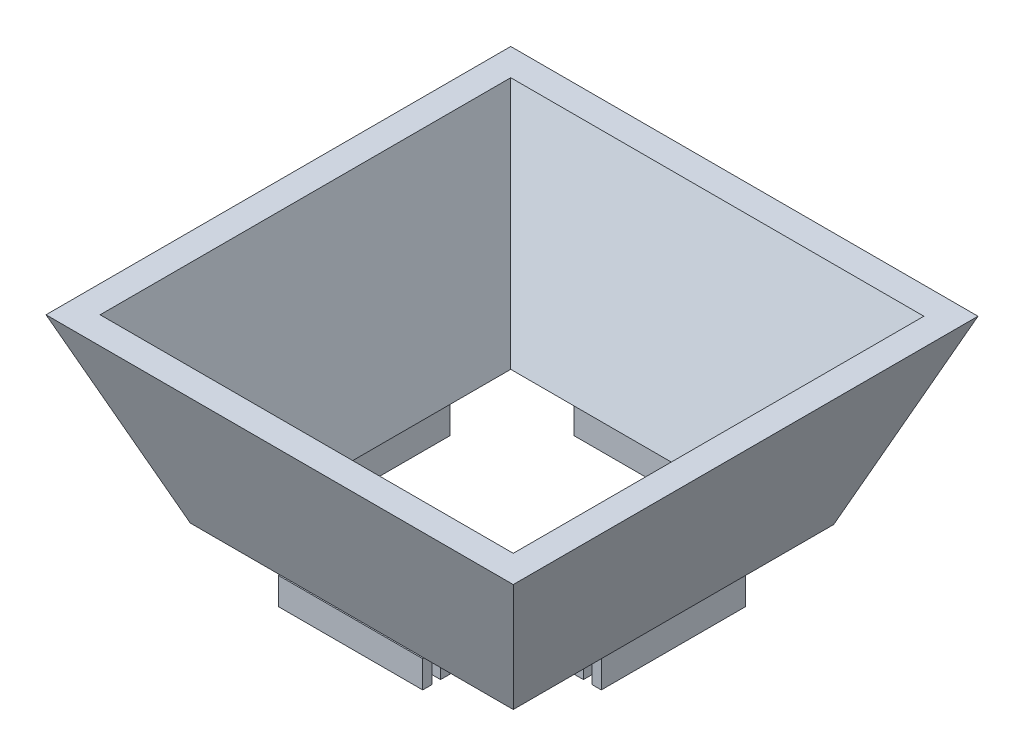
from build123d import *

# Parameters (mm, degrees)
SKETCH5_W           = 6.477
SKETCH5_H           = 101.6
SKETCH5_W_2         = 101.6
SKETCH5_H_2         = 6.477
BOSS_EXTRUDE1_DEPTH = 19.05


with BuildPart() as part:
    # Sketch2 → Loft1 section 0
    with BuildSketch(Plane(origin=(0, 127, 0), x_dir=(1, 0, 0), z_dir=(0, 1, 0))):
        with BuildLine():
            Line((-50.8, -50.8), (278.13, -50.8))
            Line((278.13, -50.8), (278.13, 276.352))
            Line((278.13, 276.352), (-50.8, 276.352))
            Line((-50.8, 276.352), (-50.8, -50.8))
        make_face()
    # Sketch1 → Loft1 section 1
    with BuildSketch(Plane(origin=(0, 0, 0), x_dir=(1, 0, 0), z_dir=(0, 1, 0))):
        with BuildLine():
            Line((0, 0), (227.33, 0))
            Line((227.33, 0), (227.33, 225.552))
            Line((227.33, 225.552), (0, 225.552))
            Line((0, 225.552), (0, 0))
        make_face()
    loft()

    # Sketch4 → Cut-Loft3 section 0
    with BuildSketch(Plane.XZ):
        with BuildLine():
            Line((208.28, -19.05), (19.05, -19.05))
            Line((19.05, -19.05), (19.05, -206.502))
            Line((19.05, -206.502), (208.28, -206.502))
            Line((208.28, -206.502), (208.28, -19.05))
        make_face()
    # Sketch3 → Cut-Loft3 section 1
    with BuildSketch(Plane(origin=(0, 127, 0), x_dir=(1, 0, 0), z_dir=(0, 1, 0))):
        with BuildLine():
            Line((-31.75, 257.302), (-31.75, -31.75))
            Line((-31.75, -31.75), (259.08, -31.75))
            Line((259.08, -31.75), (259.08, 257.302))
            Line((259.08, 257.302), (-31.75, 257.302))
        make_face()
    loft(mode=Mode.SUBTRACT)

    # Sketch5 → Boss-Extrude1 (add)
    with BuildSketch(Plane.XZ):
        with Locations((3.2385, -112.776)):
            Rectangle(SKETCH5_W, SKETCH5_H)
        with Locations((15.8115, -112.776)):
            Rectangle(SKETCH5_W, SKETCH5_H)
        with Locations((113.665, -2.3495)):
            Rectangle(SKETCH5_W_2, SKETCH5_H_2)
        with Locations((113.665, -14.9225)):
            Rectangle(SKETCH5_W_2, SKETCH5_H_2)
        with Locations((224.0915, -112.776)):
            Rectangle(SKETCH5_W, SKETCH5_H)
        with Locations((211.5185, -112.776)):
            Rectangle(SKETCH5_W, SKETCH5_H)
        with Locations((113.665, -223.2025)):
            Rectangle(SKETCH5_W_2, SKETCH5_H_2)
        with Locations((113.665, -210.6295)):
            Rectangle(SKETCH5_W_2, SKETCH5_H_2)
    extrude(amount=BOSS_EXTRUDE1_DEPTH)


solid = part.part
